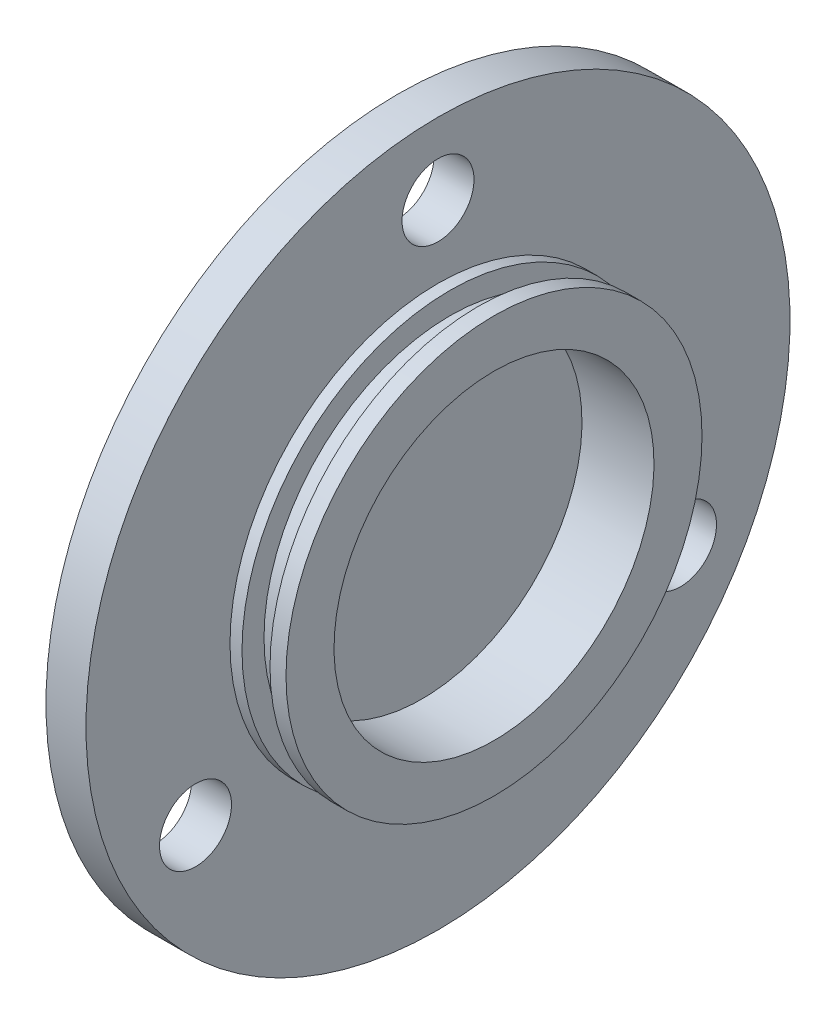
from build123d import *

# Parameters (mm, degrees)
SCHIZZO2_R               = 4.5
TAGLIO_ESTRUSIONE1_DEPTH = 63.617888818


with BuildPart() as part:
    # Schizzo1 → Rivoluzione1 (revolve)
    with BuildSketch(Plane.XY):
        Polygon((0, 0), (0, 44), (5, 44), (5, 26), (6.5, 26), (6.5, 23.25), (10, 23.25), (10, 26), (12, 26), (12, 20), (3, 20), (3, 0), align=None)
    revolve(axis=Axis((3, 0, 0), (-1, 0, 0)))

    # Schizzo2 → Taglio-Estrusione1 (cut, through all)
    with BuildSketch(Plane(origin=(5, 0, 0), x_dir=(0, 0, -1), z_dir=(1, 0, 0))):
        with Locations(Location((0, 35, 0), (0, 0, 90))):
            Circle(SCHIZZO2_R)
        with Locations(Location((30.310889132, -17.5, 0), (0, 0, 90))):
            Circle(SCHIZZO2_R)
        with Locations(Location((-30.310889132, -17.5, 0), (0, 0, 90))):
            Circle(SCHIZZO2_R)
    extrude(amount=-TAGLIO_ESTRUSIONE1_DEPTH, mode=Mode.SUBTRACT)


solid = part.part
